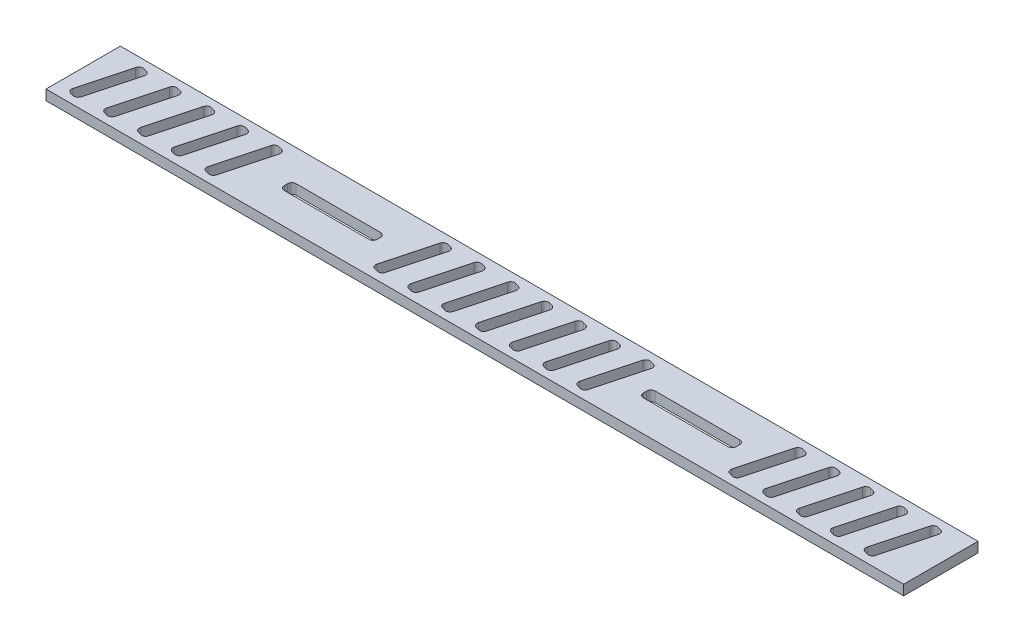
from build123d import *

# Parameters (mm, degrees)
SKETCH1_W           = 253.73
SKETCH1_H           = 22
BOSS_EXTRUDE1_DEPTH = 3


with BuildPart() as part:
    # Sketch1 → Boss-Extrude1 (new body)
    with BuildSketch(Plane(origin=(0, 0, 0), x_dir=(1, 0, 0), z_dir=(0, 1, 0))):
        Rectangle(SKETCH1_W, SKETCH1_H)
        with BuildLine():
            Line((-123.041476194, -6.886726059), (-119.108164582, 7.792592717))
            ThreePointArc((-119.108164582, 7.792592717), (-118.525757299, 8.551600665), (-117.577233493, 8.676476194))
            Line((-117.577233493, 8.676476194), (-116.611307667, 8.417657149))
            ThreePointArc((-116.611307667, 8.417657149), (-115.852299718, 7.835249866), (-115.72742419, 6.886726059))
            Line((-115.72742419, 6.886726059), (-119.660735802, -7.792592717))
            ThreePointArc((-119.660735802, -7.792592717), (-120.243143084, -8.551600665), (-121.191666891, -8.676476194))
            Line((-121.191666891, -8.676476194), (-122.157592717, -8.417657149))
            ThreePointArc((-122.157592717, -8.417657149), (-122.916600665, -7.835249866), (-123.041476194, -6.886726059))
        make_face(mode=Mode.SUBTRACT)
        with BuildLine():
            Line((-113.041476194, -6.886726059), (-109.108164582, 7.792592717))
            ThreePointArc((-109.108164582, 7.792592717), (-108.525757299, 8.551600665), (-107.577233493, 8.676476194))
            Line((-107.577233493, 8.676476194), (-106.611307667, 8.417657149))
            ThreePointArc((-106.611307667, 8.417657149), (-105.852299718, 7.835249866), (-105.72742419, 6.886726059))
            Line((-105.72742419, 6.886726059), (-109.660735802, -7.792592717))
            ThreePointArc((-109.660735802, -7.792592717), (-110.243143084, -8.551600665), (-111.191666891, -8.676476194))
            Line((-111.191666891, -8.676476194), (-112.157592717, -8.417657149))
            ThreePointArc((-112.157592717, -8.417657149), (-112.916600665, -7.835249866), (-113.041476194, -6.886726059))
        make_face(mode=Mode.SUBTRACT)
        with BuildLine():
            Line((-103.041476194, -6.886726059), (-99.108164582, 7.792592717))
            ThreePointArc((-99.108164582, 7.792592717), (-98.525757299, 8.551600665), (-97.577233493, 8.676476194))
            Line((-97.577233493, 8.676476194), (-96.611307667, 8.417657149))
            ThreePointArc((-96.611307667, 8.417657149), (-95.852299718, 7.835249866), (-95.72742419, 6.886726059))
            Line((-95.72742419, 6.886726059), (-99.660735802, -7.792592717))
            ThreePointArc((-99.660735802, -7.792592717), (-100.243143084, -8.551600665), (-101.191666891, -8.676476194))
            Line((-101.191666891, -8.676476194), (-102.157592717, -8.417657149))
            ThreePointArc((-102.157592717, -8.417657149), (-102.916600665, -7.835249866), (-103.041476194, -6.886726059))
        make_face(mode=Mode.SUBTRACT)
        with BuildLine():
            Line((-93.041476194, -6.886726059), (-89.108164582, 7.792592717))
            ThreePointArc((-89.108164582, 7.792592717), (-88.525757299, 8.551600665), (-87.577233493, 8.676476194))
            Line((-87.577233493, 8.676476194), (-86.611307667, 8.417657149))
            ThreePointArc((-86.611307667, 8.417657149), (-85.852299718, 7.835249866), (-85.72742419, 6.886726059))
            Line((-85.72742419, 6.886726059), (-89.660735802, -7.792592717))
            ThreePointArc((-89.660735802, -7.792592717), (-90.243143084, -8.551600665), (-91.191666891, -8.676476194))
            Line((-91.191666891, -8.676476194), (-92.157592717, -8.417657149))
            ThreePointArc((-92.157592717, -8.417657149), (-92.916600665, -7.835249866), (-93.041476194, -6.886726059))
        make_face(mode=Mode.SUBTRACT)
        with BuildLine():
            Line((-83.041476194, -6.886726059), (-79.108164582, 7.792592717))
            ThreePointArc((-79.108164582, 7.792592717), (-78.525757299, 8.551600665), (-77.577233493, 8.676476194))
            Line((-77.577233493, 8.676476194), (-76.611307667, 8.417657149))
            ThreePointArc((-76.611307667, 8.417657149), (-75.852299718, 7.835249866), (-75.72742419, 6.886726059))
            Line((-75.72742419, 6.886726059), (-79.660735802, -7.792592717))
            ThreePointArc((-79.660735802, -7.792592717), (-80.243143084, -8.551600665), (-81.191666891, -8.676476194))
            Line((-81.191666891, -8.676476194), (-82.157592717, -8.417657149))
            ThreePointArc((-82.157592717, -8.417657149), (-82.916600665, -7.835249866), (-83.041476194, -6.886726059))
        make_face(mode=Mode.SUBTRACT)
        with BuildLine():
            Line((-33.041476194, -6.886726059), (-29.108164582, 7.792592717))
            ThreePointArc((-29.108164582, 7.792592717), (-28.525757299, 8.551600665), (-27.577233493, 8.676476194))
            Line((-27.577233493, 8.676476194), (-26.611307667, 8.417657149))
            ThreePointArc((-26.611307667, 8.417657149), (-25.852299718, 7.835249866), (-25.72742419, 6.886726059))
            Line((-25.72742419, 6.886726059), (-29.660735802, -7.792592717))
            ThreePointArc((-29.660735802, -7.792592717), (-30.243143084, -8.551600665), (-31.191666891, -8.676476194))
            Line((-31.191666891, -8.676476194), (-32.157592717, -8.417657149))
            ThreePointArc((-32.157592717, -8.417657149), (-32.916600665, -7.835249866), (-33.041476194, -6.886726059))
        make_face(mode=Mode.SUBTRACT)
        with BuildLine():
            Line((-65.615, -1.755461545), (-40.615, -1.755461545))
            ThreePointArc((-40.615, -1.755461545), (-39.731116524, -1.389345021), (-39.365, -0.505461545))
            Line((-39.365, -0.505461545), (-39.365, 0.494538455))
            ThreePointArc((-39.365, 0.494538455), (-39.731116524, 1.378421932), (-40.615, 1.744538455))
            Line((-40.615, 1.744538455), (-65.615, 1.744538455))
            ThreePointArc((-65.615, 1.744538455), (-66.498883476, 1.378421932), (-66.865, 0.494538455))
            Line((-66.865, 0.494538455), (-66.865, -0.505461545))
            ThreePointArc((-66.865, -0.505461545), (-66.498883476, -1.389345021), (-65.615, -1.755461545))
        make_face(mode=Mode.SUBTRACT)
        with BuildLine():
            Line((-23.041476194, -6.886726059), (-19.108164582, 7.792592717))
            ThreePointArc((-19.108164582, 7.792592717), (-18.525757299, 8.551600665), (-17.577233493, 8.676476194))
            Line((-17.577233493, 8.676476194), (-16.611307667, 8.417657149))
            ThreePointArc((-16.611307667, 8.417657149), (-15.852299718, 7.835249866), (-15.72742419, 6.886726059))
            Line((-15.72742419, 6.886726059), (-19.660735802, -7.792592717))
            ThreePointArc((-19.660735802, -7.792592717), (-20.243143084, -8.551600665), (-21.191666891, -8.676476194))
            Line((-21.191666891, -8.676476194), (-22.157592717, -8.417657149))
            ThreePointArc((-22.157592717, -8.417657149), (-22.916600665, -7.835249866), (-23.041476194, -6.886726059))
        make_face(mode=Mode.SUBTRACT)
        with BuildLine():
            Line((-13.041476194, -6.886726059), (-9.108164582, 7.792592717))
            ThreePointArc((-9.108164582, 7.792592717), (-8.525757299, 8.551600665), (-7.577233493, 8.676476194))
            Line((-7.577233493, 8.676476194), (-6.611307667, 8.417657149))
            ThreePointArc((-6.611307667, 8.417657149), (-5.852299718, 7.835249866), (-5.72742419, 6.886726059))
            Line((-5.72742419, 6.886726059), (-9.660735802, -7.792592717))
            ThreePointArc((-9.660735802, -7.792592717), (-10.243143084, -8.551600665), (-11.191666891, -8.676476194))
            Line((-11.191666891, -8.676476194), (-12.157592717, -8.417657149))
            ThreePointArc((-12.157592717, -8.417657149), (-12.916600665, -7.835249866), (-13.041476194, -6.886726059))
        make_face(mode=Mode.SUBTRACT)
        with BuildLine():
            Line((39.365, -0.505461545), (39.365, 0.494538455))
            ThreePointArc((39.365, 0.494538455), (39.731116524, 1.378421932), (40.615, 1.744538455))
            Line((40.615, 1.744538455), (65.615, 1.744538455))
            ThreePointArc((65.615, 1.744538455), (66.498883476, 1.378421932), (66.865, 0.494538455))
            Line((66.865, 0.494538455), (66.865, -0.505461545))
            ThreePointArc((66.865, -0.505461545), (66.498883476, -1.389345021), (65.615, -1.755461545))
            Line((65.615, -1.755461545), (40.615, -1.755461545))
            ThreePointArc((40.615, -1.755461545), (39.731116524, -1.389345021), (39.365, -0.505461545))
        make_face(mode=Mode.SUBTRACT)
        with BuildLine():
            Line((-3.041476194, -6.886726059), (0.891835418, 7.792592717))
            ThreePointArc((0.891835418, 7.792592717), (1.474242701, 8.551600665), (2.422766507, 8.676476194))
            Line((2.422766507, 8.676476194), (3.388692333, 8.417657149))
            ThreePointArc((3.388692333, 8.417657149), (4.147700282, 7.835249866), (4.27257581, 6.886726059))
            Line((4.27257581, 6.886726059), (0.339264198, -7.792592717))
            ThreePointArc((0.339264198, -7.792592717), (-0.243143084, -8.551600665), (-1.191666891, -8.676476194))
            Line((-1.191666891, -8.676476194), (-2.157592717, -8.417657149))
            ThreePointArc((-2.157592717, -8.417657149), (-2.916600665, -7.835249866), (-3.041476194, -6.886726059))
        make_face(mode=Mode.SUBTRACT)
        with BuildLine():
            Line((6.958523806, -6.886726059), (10.891835418, 7.792592717))
            ThreePointArc((10.891835418, 7.792592717), (11.474242701, 8.551600665), (12.422766507, 8.676476194))
            Line((12.422766507, 8.676476194), (13.388692333, 8.417657149))
            ThreePointArc((13.388692333, 8.417657149), (14.147700282, 7.835249866), (14.27257581, 6.886726059))
            Line((14.27257581, 6.886726059), (10.339264198, -7.792592717))
            ThreePointArc((10.339264198, -7.792592717), (9.756856916, -8.551600665), (8.808333109, -8.676476194))
            Line((8.808333109, -8.676476194), (7.842407283, -8.417657149))
            ThreePointArc((7.842407283, -8.417657149), (7.083399335, -7.835249866), (6.958523806, -6.886726059))
        make_face(mode=Mode.SUBTRACT)
        with BuildLine():
            Line((16.958523806, -6.886726059), (20.891835418, 7.792592717))
            ThreePointArc((20.891835418, 7.792592717), (21.474242701, 8.551600665), (22.422766507, 8.676476194))
            Line((22.422766507, 8.676476194), (23.388692333, 8.417657149))
            ThreePointArc((23.388692333, 8.417657149), (24.147700282, 7.835249866), (24.27257581, 6.886726059))
            Line((24.27257581, 6.886726059), (20.339264198, -7.792592717))
            ThreePointArc((20.339264198, -7.792592717), (19.756856916, -8.551600665), (18.808333109, -8.676476194))
            Line((18.808333109, -8.676476194), (17.842407283, -8.417657149))
            ThreePointArc((17.842407283, -8.417657149), (17.083399335, -7.835249866), (16.958523806, -6.886726059))
        make_face(mode=Mode.SUBTRACT)
        with BuildLine():
            Line((26.958523806, -6.886726059), (30.891835418, 7.792592717))
            ThreePointArc((30.891835418, 7.792592717), (31.474242701, 8.551600665), (32.422766507, 8.676476194))
            Line((32.422766507, 8.676476194), (33.388692333, 8.417657149))
            ThreePointArc((33.388692333, 8.417657149), (34.147700282, 7.835249866), (34.27257581, 6.886726059))
            Line((34.27257581, 6.886726059), (30.339264198, -7.792592717))
            ThreePointArc((30.339264198, -7.792592717), (29.756856916, -8.551600665), (28.808333109, -8.676476194))
            Line((28.808333109, -8.676476194), (27.842407283, -8.417657149))
            ThreePointArc((27.842407283, -8.417657149), (27.083399335, -7.835249866), (26.958523806, -6.886726059))
        make_face(mode=Mode.SUBTRACT)
        with BuildLine():
            Line((71.958523806, -6.886726059), (75.891835418, 7.792592717))
            ThreePointArc((75.891835418, 7.792592717), (76.474242701, 8.551600665), (77.422766507, 8.676476194))
            Line((77.422766507, 8.676476194), (78.388692333, 8.417657149))
            ThreePointArc((78.388692333, 8.417657149), (79.147700282, 7.835249866), (79.27257581, 6.886726059))
            Line((79.27257581, 6.886726059), (75.339264198, -7.792592717))
            ThreePointArc((75.339264198, -7.792592717), (74.756856916, -8.551600665), (73.808333109, -8.676476194))
            Line((73.808333109, -8.676476194), (72.842407283, -8.417657149))
            ThreePointArc((72.842407283, -8.417657149), (72.083399335, -7.835249866), (71.958523806, -6.886726059))
        make_face(mode=Mode.SUBTRACT)
        with BuildLine():
            Line((81.958523806, -6.886726059), (85.891835418, 7.792592717))
            ThreePointArc((85.891835418, 7.792592717), (86.474242701, 8.551600665), (87.422766507, 8.676476194))
            Line((87.422766507, 8.676476194), (88.388692333, 8.417657149))
            ThreePointArc((88.388692333, 8.417657149), (89.147700282, 7.835249866), (89.27257581, 6.886726059))
            Line((89.27257581, 6.886726059), (85.339264198, -7.792592717))
            ThreePointArc((85.339264198, -7.792592717), (84.756856916, -8.551600665), (83.808333109, -8.676476194))
            Line((83.808333109, -8.676476194), (82.842407283, -8.417657149))
            ThreePointArc((82.842407283, -8.417657149), (82.083399335, -7.835249866), (81.958523806, -6.886726059))
        make_face(mode=Mode.SUBTRACT)
        with BuildLine():
            Line((91.958523806, -6.886726059), (95.891835418, 7.792592717))
            ThreePointArc((95.891835418, 7.792592717), (96.474242701, 8.551600665), (97.422766507, 8.676476194))
            Line((97.422766507, 8.676476194), (98.388692333, 8.417657149))
            ThreePointArc((98.388692333, 8.417657149), (99.147700282, 7.835249866), (99.27257581, 6.886726059))
            Line((99.27257581, 6.886726059), (95.339264198, -7.792592717))
            ThreePointArc((95.339264198, -7.792592717), (94.756856916, -8.551600665), (93.808333109, -8.676476194))
            Line((93.808333109, -8.676476194), (92.842407283, -8.417657149))
            ThreePointArc((92.842407283, -8.417657149), (92.083399335, -7.835249866), (91.958523806, -6.886726059))
        make_face(mode=Mode.SUBTRACT)
        with BuildLine():
            Line((101.958523806, -6.886726059), (105.891835418, 7.792592717))
            ThreePointArc((105.891835418, 7.792592717), (106.474242701, 8.551600665), (107.422766507, 8.676476194))
            Line((107.422766507, 8.676476194), (108.388692333, 8.417657149))
            ThreePointArc((108.388692333, 8.417657149), (109.147700282, 7.835249866), (109.27257581, 6.886726059))
            Line((109.27257581, 6.886726059), (105.339264198, -7.792592717))
            ThreePointArc((105.339264198, -7.792592717), (104.756856916, -8.551600665), (103.808333109, -8.676476194))
            Line((103.808333109, -8.676476194), (102.842407283, -8.417657149))
            ThreePointArc((102.842407283, -8.417657149), (102.083399335, -7.835249866), (101.958523806, -6.886726059))
        make_face(mode=Mode.SUBTRACT)
        with BuildLine():
            Line((111.958523806, -6.886726059), (115.891835418, 7.792592717))
            ThreePointArc((115.891835418, 7.792592717), (116.474242701, 8.551600665), (117.422766507, 8.676476194))
            Line((117.422766507, 8.676476194), (118.388692333, 8.417657149))
            ThreePointArc((118.388692333, 8.417657149), (119.147700282, 7.835249866), (119.27257581, 6.886726059))
            Line((119.27257581, 6.886726059), (115.339264198, -7.792592717))
            ThreePointArc((115.339264198, -7.792592717), (114.756856916, -8.551600665), (113.808333109, -8.676476194))
            Line((113.808333109, -8.676476194), (112.842407283, -8.417657149))
            ThreePointArc((112.842407283, -8.417657149), (112.083399335, -7.835249866), (111.958523806, -6.886726059))
        make_face(mode=Mode.SUBTRACT)
    extrude(amount=BOSS_EXTRUDE1_DEPTH)


solid = part.part
